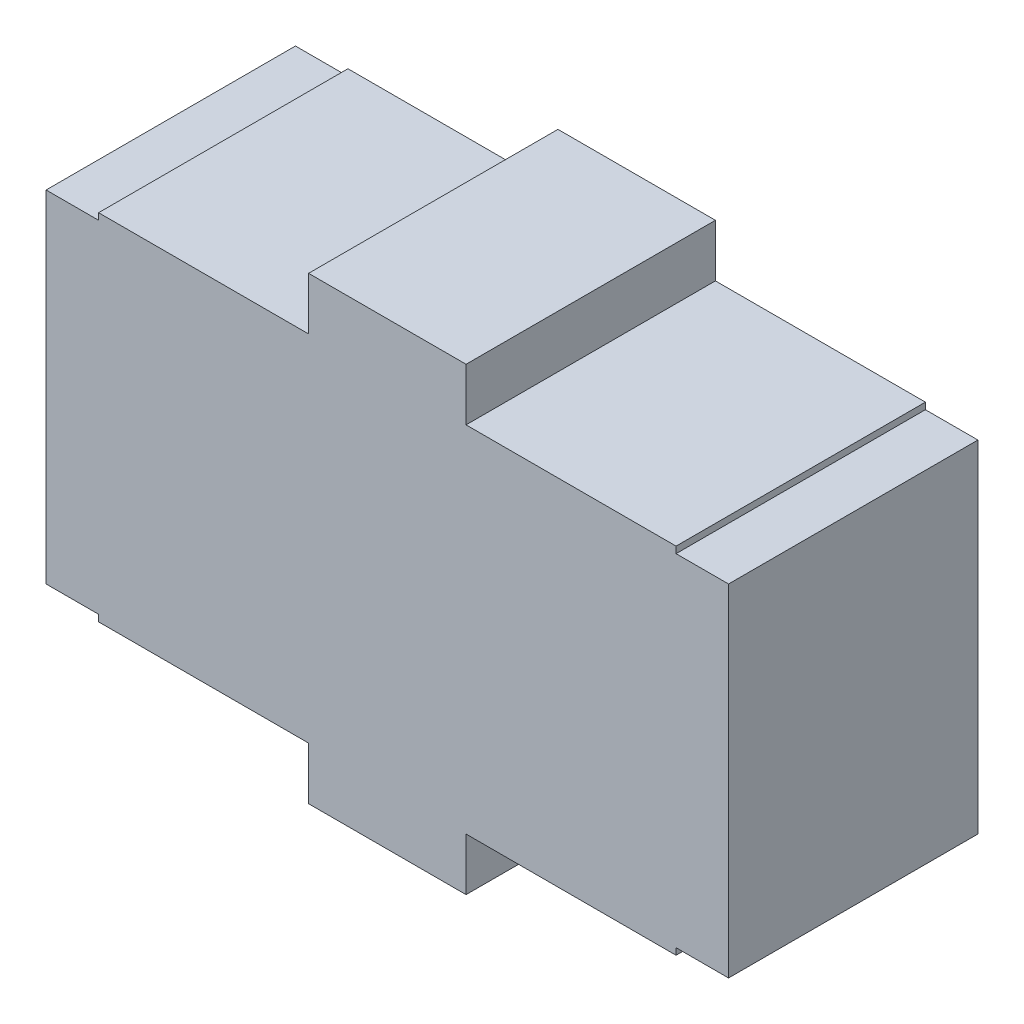
from build123d import *

# Parameters (mm, degrees)
COMPONENT_OUTLINE_DEPTH = 0.95


with BuildPart() as part:
    # 草图1 → Component_Outline (new body)
    with BuildSketch(Plane.XY):
        Polygon((-0.3, -0.875), (-0.3, -0.675), (-1.1, -0.675), (-1.1, -0.65), (-1.3, -0.65), (-1.3, 0.65), (-1.1, 0.65), (-1.1, 0.675), (-0.3, 0.675), (-0.3, 0.875), (0.3, 0.875), (0.3, 0.675), (1.1, 0.675), (1.1, 0.65), (1.3, 0.65), (1.3, -0.65), (1.1, -0.65), (1.1, -0.675), (0.3, -0.675), (0.3, -0.875), align=None)
    extrude(amount=COMPONENT_OUTLINE_DEPTH)


solid = part.part
